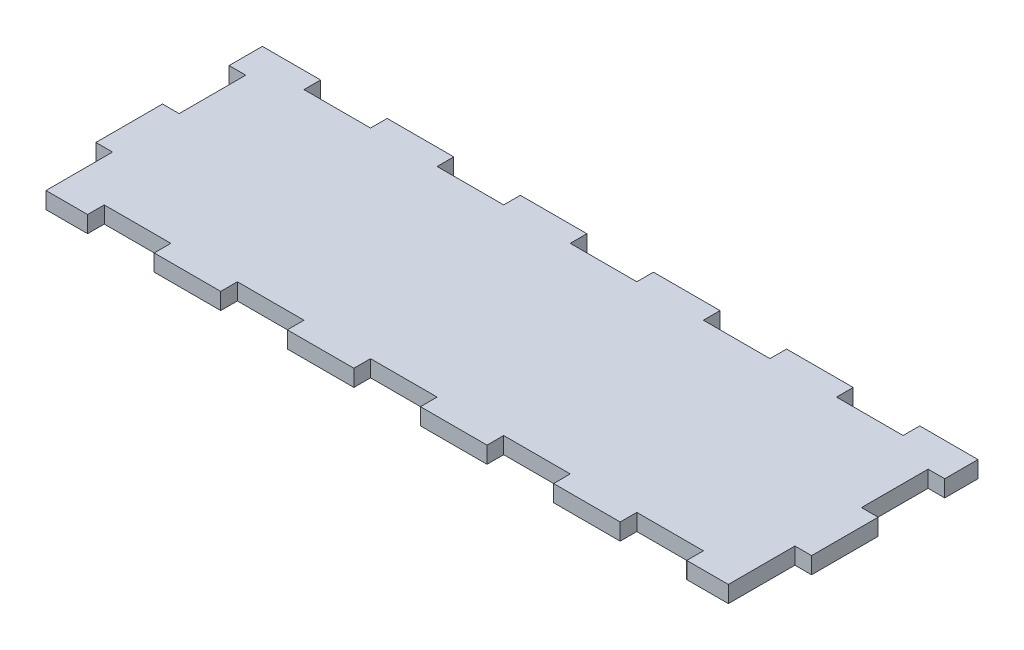
from build123d import *

# Parameters (mm, degrees)
SKETCH_1_W               = 215
SKETCH_1_H               = 70
EXTRUDE_1_DEPTH          = 5
CUT_EXTRUDE_1_REACH      = 115.165
SKETCH_2_W               = 20
SKETCH_2_H               = 5
PATTERN_LINEAR_1_COUNT   = 3
PATTERN_LINEAR_1_PITCH   = 40
PATTERN_LINEAR_2_COUNT   = 3
PATTERN_LINEAR_2_PITCH   = 40
CUT_EXTRUDE_2_REACH      = 115.165
SKETCH_3_W               = 5
SKETCH_3_H               = 20
PATTERN_LINEAR_3_COUNT   = 2
PATTERN_LINEAR_3_PITCH   = 40
MIRROR_1_COPY_1_REACH    = 115.165
MIRROR_1_COPY_1_SKETCH_W = 5
MIRROR_1_COPY_1_SKETCH_H = 20
MIRROR_3_COPY_1_REACH    = 115.165
MIRROR_3_COPY_1_SKETCH_W = 20
MIRROR_3_COPY_1_SKETCH_H = 5
MIRROR_3_COPY_2_REACH    = 115.165
MIRROR_3_COPY_2_SKETCH_W = 20
MIRROR_3_COPY_2_SKETCH_H = 5
MIRROR_3_COPY_3_REACH    = 115.165
MIRROR_3_COPY_3_SKETCH_W = 20
MIRROR_3_COPY_3_SKETCH_H = 5
MIRROR_3_COPY_4_REACH    = 115.165
MIRROR_3_COPY_4_SKETCH_W = 20
MIRROR_3_COPY_4_SKETCH_H = 5


with BuildPart() as part:
    # 스케치1 → 보스-돌출1 (new body)
    with BuildSketch(Plane(origin=(0, 0, 0), x_dir=(1, 0, 0), z_dir=(0, 1, 0))):
        Rectangle(SKETCH_1_W, SKETCH_1_H)
    extrude(amount=EXTRUDE_1_DEPTH)

    # 스케치2 → 컷-돌출1 (cut, up to next)
    with BuildSketch(Plane(origin=(0, 5, 0), x_dir=(1, 0, 0), z_dir=(0, 1, 0)), mode=Mode.PRIVATE) as cut_extrude_1_sk1:
        with Locations((0, -32.5)):
            Rectangle(SKETCH_2_W, SKETCH_2_H)
    cut_extrude_1_tool1 = extrude(cut_extrude_1_sk1.sketch, amount=-CUT_EXTRUDE_1_REACH, mode=Mode.PRIVATE) & part.part
    cut_extrude_1 = cut_extrude_1_tool1.solids().sort_by_distance((0, 5, 32.5))[0]
    add(cut_extrude_1, mode=Mode.SUBTRACT)

    # 선형 패턴1: 컷-돌출1 ×3
    with Locations(*[(i * PATTERN_LINEAR_1_PITCH, 0, 0) for i in range(1, PATTERN_LINEAR_1_COUNT)]):
        add(cut_extrude_1, mode=Mode.SUBTRACT)

    # 선형 패턴2: 컷-돌출1 ×3
    with Locations(*[(-i * PATTERN_LINEAR_2_PITCH, 0, 0) for i in range(1, PATTERN_LINEAR_2_COUNT)]):
        add(cut_extrude_1, mode=Mode.SUBTRACT)

    # 스케치3 → 컷-돌출2 (cut, up to next)
    with BuildSketch(Plane(origin=(0, 5, 0), x_dir=(1, 0, 0), z_dir=(0, 1, 0)), mode=Mode.PRIVATE) as cut_extrude_2_sk1:
        with Locations((105, -25)):
            Rectangle(SKETCH_3_W, SKETCH_3_H)
    cut_extrude_2_tool1 = extrude(cut_extrude_2_sk1.sketch, amount=-CUT_EXTRUDE_2_REACH, mode=Mode.PRIVATE) & part.part
    cut_extrude_2 = cut_extrude_2_tool1.solids().sort_by_distance((105, 5, 25))[0]
    add(cut_extrude_2, mode=Mode.SUBTRACT)

    # 선형 패턴3: 컷-돌출2 ×2
    with Locations(*[(0, 0, -i * PATTERN_LINEAR_3_PITCH) for i in range(1, PATTERN_LINEAR_3_COUNT)]):
        add(cut_extrude_2, mode=Mode.SUBTRACT)

    # 대칭 복사1: 컷-돌출2 across plane
    add(cut_extrude_2.mirror(Plane(origin=(0, 0, 0), x_dir=(0, 0, 1), z_dir=(1, 0, 0))), mode=Mode.SUBTRACT)

    # 대칭 복사1 copy 1 sketch → 대칭 복사1 copy 1 (cut, up to next)
    with BuildSketch(Plane(origin=(0, 5, -40), x_dir=(-1, 0, 0), z_dir=(0, 1, 0)), mode=Mode.PRIVATE) as mirror_1_copy_1_sk1:
        with Locations((105, 25)):
            Rectangle(MIRROR_1_COPY_1_SKETCH_W, MIRROR_1_COPY_1_SKETCH_H)
    mirror_1_copy_1_tool1 = extrude(mirror_1_copy_1_sk1.sketch, amount=-MIRROR_1_COPY_1_REACH, mode=Mode.PRIVATE) & part.part
    add(mirror_1_copy_1_tool1.solids().sort_by_distance((-105, 5, -15))[0], mode=Mode.SUBTRACT)

    # 대칭 복사3: 컷-돌출1 across plane
    add(cut_extrude_1.mirror(Plane.XY), mode=Mode.SUBTRACT)

    # 대칭 복사3 copy 1 sketch → 대칭 복사3 copy 1 (cut, up to next)
    with BuildSketch(Plane(origin=(40, 5, 0), x_dir=(1, 0, 0), z_dir=(0, 1, 0)), mode=Mode.PRIVATE) as mirror_3_copy_1_sk1:
        with Locations((0, 32.5)):
            Rectangle(MIRROR_3_COPY_1_SKETCH_W, MIRROR_3_COPY_1_SKETCH_H)
    mirror_3_copy_1_tool1 = extrude(mirror_3_copy_1_sk1.sketch, amount=-MIRROR_3_COPY_1_REACH, mode=Mode.PRIVATE) & part.part
    add(mirror_3_copy_1_tool1.solids().sort_by_distance((40, 5, -32.5))[0], mode=Mode.SUBTRACT)

    # 대칭 복사3 copy 2 sketch → 대칭 복사3 copy 2 (cut, up to next)
    with BuildSketch(Plane(origin=(80, 5, 0), x_dir=(1, 0, 0), z_dir=(0, 1, 0)), mode=Mode.PRIVATE) as mirror_3_copy_2_sk1:
        with Locations((0, 32.5)):
            Rectangle(MIRROR_3_COPY_2_SKETCH_W, MIRROR_3_COPY_2_SKETCH_H)
    mirror_3_copy_2_tool1 = extrude(mirror_3_copy_2_sk1.sketch, amount=-MIRROR_3_COPY_2_REACH, mode=Mode.PRIVATE) & part.part
    add(mirror_3_copy_2_tool1.solids().sort_by_distance((80, 5, -32.5))[0], mode=Mode.SUBTRACT)

    # 대칭 복사3 copy 3 sketch → 대칭 복사3 copy 3 (cut, up to next)
    with BuildSketch(Plane(origin=(-40, 5, 0), x_dir=(1, 0, 0), z_dir=(0, 1, 0)), mode=Mode.PRIVATE) as mirror_3_copy_3_sk1:
        with Locations((0, 32.5)):
            Rectangle(MIRROR_3_COPY_3_SKETCH_W, MIRROR_3_COPY_3_SKETCH_H)
    mirror_3_copy_3_tool1 = extrude(mirror_3_copy_3_sk1.sketch, amount=-MIRROR_3_COPY_3_REACH, mode=Mode.PRIVATE) & part.part
    add(mirror_3_copy_3_tool1.solids().sort_by_distance((-40, 5, -32.5))[0], mode=Mode.SUBTRACT)

    # 대칭 복사3 copy 4 sketch → 대칭 복사3 copy 4 (cut, up to next)
    with BuildSketch(Plane(origin=(-80, 5, 0), x_dir=(1, 0, 0), z_dir=(0, 1, 0)), mode=Mode.PRIVATE) as mirror_3_copy_4_sk1:
        with Locations((0, 32.5)):
            Rectangle(MIRROR_3_COPY_4_SKETCH_W, MIRROR_3_COPY_4_SKETCH_H)
    mirror_3_copy_4_tool1 = extrude(mirror_3_copy_4_sk1.sketch, amount=-MIRROR_3_COPY_4_REACH, mode=Mode.PRIVATE) & part.part
    add(mirror_3_copy_4_tool1.solids().sort_by_distance((-80, 5, -32.5))[0], mode=Mode.SUBTRACT)


solid = part.part
